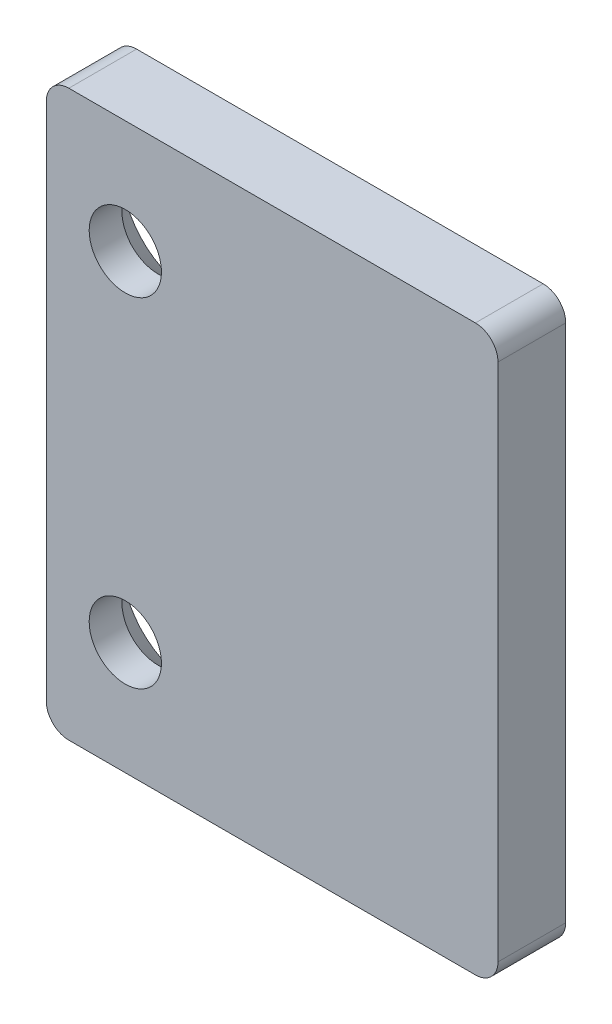
from build123d import *

# Parameters (mm, degrees)
SKETCH_1_W                  = 20
SKETCH_1_H                  = 25
SKETCH_1_R                  = 1.6
EXTRUDE_1_DEPTH             = 3
FILLET_1_R                  = 1
HOLE_WIZARD_M3_1_AT_2_COUNT = 2
HOLE_WIZARD_M3_1_AT_2_PITCH = 15


with BuildPart() as part:
    # ｽｹｯﾁ1 → ﾎﾞｽ - 押し出し1 (new body)
    with BuildSketch(Plane.XY):
        with Locations((10, 12.5)):
            Rectangle(SKETCH_1_W, SKETCH_1_H)
        with Locations((3.5, 5)):
            Circle(SKETCH_1_R, mode=Mode.SUBTRACT)
        with Locations((3.5, 20)):
            Circle(SKETCH_1_R, mode=Mode.SUBTRACT)
    extrude(amount=EXTRUDE_1_DEPTH)

    # ﾌｨﾚｯﾄ1
    fillet_1_edges = [part.edges().sort_by_distance(p)[0] for p in [
        (0, 25, 1.5),
        (20, 25, 1.5),
        (20, 0, 1.5),
        (0, 0, 1.5),
    ]]
    fillet(fillet_1_edges, radius=FILLET_1_R)

    # ｽｹｯﾁ3 → M3 丸皿ねじ用皿穴1 (revolve, cut)
    with BuildSketch(Plane(origin=(3.5, 20, 0), x_dir=(0, 1, 0), z_dir=(1, 0, 0))):
        Polygon((0, 0), (0, 3), (1.55, 3), (1.55, 1.6), (3.15, 0), align=None)
    hole_wizard_m3_1 = revolve(axis=Axis((3.5, 20, -6.35), (0, 0, 1)), mode=Mode.SUBTRACT)

    # M3 丸皿ねじ用皿穴1 at 2: M3 丸皿ねじ用皿穴1 ×2
    with Locations(*[(0, -i * HOLE_WIZARD_M3_1_AT_2_PITCH, 0) for i in range(1, HOLE_WIZARD_M3_1_AT_2_COUNT)]):
        add(hole_wizard_m3_1, mode=Mode.SUBTRACT)


solid = part.part
